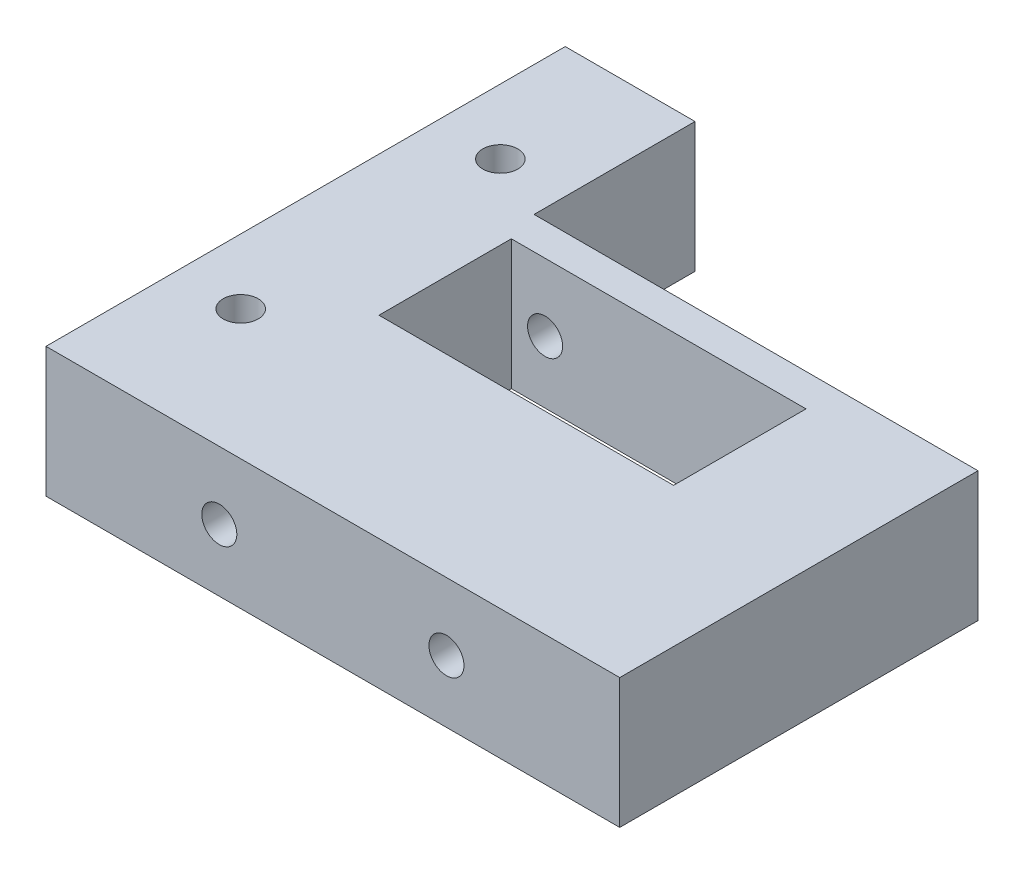
from build123d import *

# Parameters (mm, degrees)
SKETCH1_W           = 112.268
SKETCH1_H           = 101.6
SKETCH1_W_2         = 57.658
SKETCH1_H_2         = 25.908
BOSS_EXTRUDE1_DEPTH = 25.4
SKETCH2_W           = 86.868
SKETCH2_H           = 31.496
CUT_EXTRUDE1_DEPTH  = 80.855030875
SKETCH4_R           = 3.429
CUT_EXTRUDE2_DEPTH  = 94.331435069
SKETCH5_R           = 3.429
CUT_EXTRUDE3_DEPTH  = 80.855030875


with BuildPart() as part:
    # Sketch1 → Boss-Extrude1 (new body)
    with BuildSketch(Plane(origin=(0, 0, 0), x_dir=(1, 0, 0), z_dir=(0, 1, 0))):
        Rectangle(SKETCH1_W, SKETCH1_H)
        Rectangle(SKETCH1_W_2, SKETCH1_H_2, mode=Mode.SUBTRACT)
    extrude(amount=BOSS_EXTRUDE1_DEPTH)

    # Sketch2 → Cut-Extrude1 (cut, through all)
    with BuildSketch(Plane(origin=(0, 0, 0), x_dir=(1, 0, 0), z_dir=(0, 1, 0))):
        with Locations((12.7, 35.052)):
            Rectangle(SKETCH2_W, SKETCH2_H)
    extrude(amount=CUT_EXTRUDE1_DEPTH, mode=Mode.SUBTRACT)

    # Sketch4 → Cut-Extrude2 (cut, through all)
    with BuildSketch(Plane(origin=(0, 0, -19.304), x_dir=(-1, 0, 0), z_dir=(0, 0, -1))):
        with Locations((-22.225, 12.190161911)):
            Circle(SKETCH4_R)
        with Locations((22.225, 12.190161911)):
            Circle(SKETCH4_R)
    extrude(amount=-CUT_EXTRUDE2_DEPTH, mode=Mode.SUBTRACT)

    # Sketch5 → Cut-Extrude3 (cut, through all)
    with BuildSketch(Plane(origin=(0, 25.4, 0), x_dir=(1, 0, 0), z_dir=(0, 1, 0))):
        with Locations(Location((-43.434, 25.4, 0), (0, 0, 270))):
            Circle(SKETCH5_R)
        with Locations(Location((-43.434, -25.4, 0), (0, 0, 270))):
            Circle(SKETCH5_R)
    extrude(amount=-CUT_EXTRUDE3_DEPTH, mode=Mode.SUBTRACT)


solid = part.part
